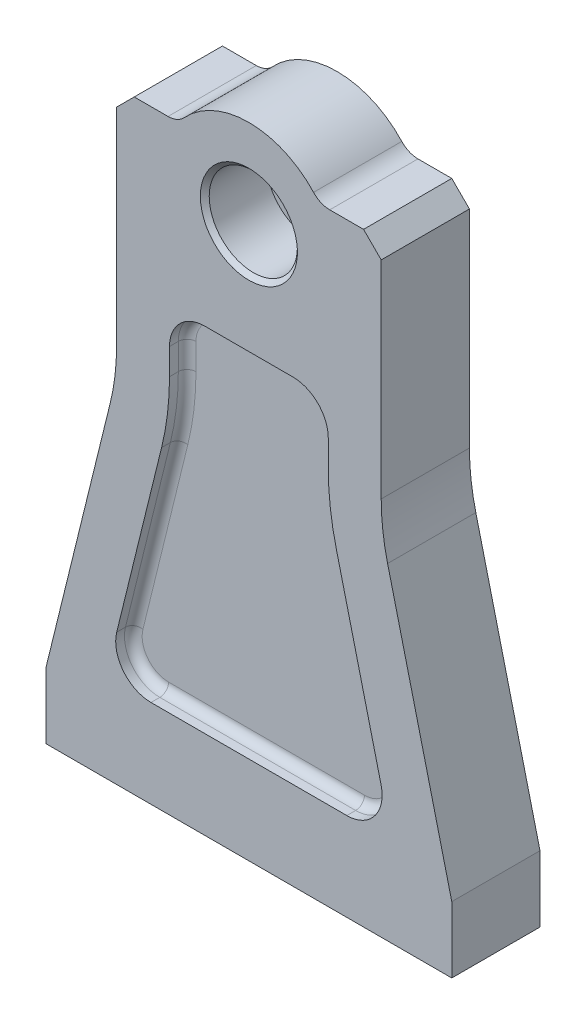
from build123d import *

# Parameters (mm, degrees)
SKETCH1_R                         = 6.5
BOSS_EXTRUDE1_DEPTH               = 10
SKETCH2_R                         = 10
CUT_EXTRUDE1_DEPTH                = 14
CHAMFER1_SIZE                     = 1
CHAMFER2_SIZE                     = 4
FILLET1_R                         = 5
CUT_EXTRUDE2_DEPTH                = 4
FILLET2_R                         = 2
FILLET2_OF_MIRROR2_R              = 2
M10X1_25_TAPPED_HOLE1_D           = 8.8
M10X1_25_TAPPED_HOLE1_DEPTH       = 20
M10X1_25_TAPPED_HOLE1_CSINK_D     = 10.05
M10X1_25_TAPPED_HOLE1_CSINK_ANGLE = 90
M10X1_25_TAPPED_HOLE1_TIP         = 2.643786724


with BuildPart() as part:
    # Sketch1 → Boss-Extrude1 (new, symmetric)
    with BuildSketch(Plane.XY):
        with BuildLine():
            Line((-46, 0), (46, 0))
            Line((46, 0), (46, 15))
            Line((46, 15), (31.449256053, 74.112397284))
            ThreePointArc((31.449256053, 74.112397284), (30.363636327, 80.044097084), (30, 86.06334964))
            Line((30, 86.06334964), (30, 137))
            Line((30, 137), (16, 137))
            ThreePointArc((16, 137), (0, 145), (-16, 137))
            Line((-16, 137), (-30, 137))
            Line((-30, 137), (-30, 86.06334964))
            ThreePointArc((-30, 86.06334964), (-30.363636327, 80.044097084), (-31.449256053, 74.112397284))
            Line((-31.449256053, 74.112397284), (-46, 15))
            Line((-46, 15), (-46, 0))
        make_face()
        with Locations((0, 125)):
            Circle(SKETCH1_R, mode=Mode.SUBTRACT)
    extrude(amount=BOSS_EXTRUDE1_DEPTH, both=True)

    # Sketch2 → Cut-Extrude1 (cut)
    with BuildSketch(Plane.XY.offset(10)):
        with Locations((0, 125)):
            Circle(SKETCH2_R)
    extrude(amount=-CUT_EXTRUDE1_DEPTH, mode=Mode.SUBTRACT)

    # Chamfer1
    chamfer1_edges = [part.edges().sort_by_distance(p)[0] for p in [
        (-10, 125, 10),
    ]]
    chamfer(chamfer1_edges, length=CHAMFER1_SIZE)

    # Chamfer2
    chamfer2_edges = [part.edges().sort_by_distance(p)[0] for p in [
        (-30, 137, 0),
        (30, 137, 0),
    ]]
    chamfer(chamfer2_edges, length=CHAMFER2_SIZE)

    # Fillet1
    fillet1_edges = [part.edges().sort_by_distance(p)[0] for p in [
        (-16, 137, 0),
        (16, 137, 0),
    ]]
    fillet(fillet1_edges, radius=FILLET1_R)

    # Sketch10 → Cut-Extrude2 (cut)
    with BuildSketch(Plane.XY.offset(10)):
        with BuildLine():
            ThreePointArc((18, 86.06334964), (18.450909046, 78.59947647), (19.797077506, 71.244168718))
            Line((19.797077506, 71.244168718), (29.971112298, 29.912152377))
            ThreePointArc((29.971112298, 29.912152377), (28.49970745, 23.065287193), (22.202993266, 20))
            Line((22.202993266, 20), (-22.202993266, 20))
            ThreePointArc((-22.202993266, 20), (-28.49970745, 23.065287193), (-29.971112298, 29.912152377))
            Line((-29.971112298, 29.912152377), (-19.797077506, 71.244168718))
            ThreePointArc((-19.797077506, 71.244168718), (-18.450909046, 78.59947647), (-18, 86.06334964))
            Line((-18, 86.06334964), (-18, 92))
            ThreePointArc((-18, 92), (-15.656854249, 97.656854249), (-10, 100))
            Line((-10, 100), (10, 100))
            ThreePointArc((10, 100), (15.656854249, 97.656854249), (18, 92))
            Line((18, 92), (18, 86.06334964))
        make_face()
    cut_extrude2 = extrude(amount=-CUT_EXTRUDE2_DEPTH, mode=Mode.SUBTRACT)

    # Fillet2
    fillet2_edges = [part.edges().sort_by_distance(p)[0] for p in [
        (-24.884094902, 50.578160548, 6),
        (-18, 89.03167482, 6),
        (15.656854249, 97.656854249, 6),
        (18, 89.03167482, 6),
        (18.450909046, 78.59947647, 6),
        (-28.49970745, 23.065287193, 6),
        (-18.450909046, 78.59947647, 6),
        (-15.656854249, 97.656854249, 6),
        (0, 100, 6),
        (24.884094902, 50.578160548, 6),
        (28.49970745, 23.065287193, 6),
        (0, 20, 6),
    ]]
    fillet(fillet2_edges, radius=FILLET2_R)

    # Mirror2: Cut-Extrude2 across plane
    add(cut_extrude2.mirror(Plane.XY), mode=Mode.SUBTRACT)

    # Fillet2 of Mirror2
    fillet2_of_mirror2_edges = [part.edges().sort_by_distance(p)[0] for p in [
        (-24.884094902, 50.578160548, -6),
        (-18, 89.03167482, -6),
        (15.656854249, 97.656854249, -6),
        (18, 89.03167482, -6),
        (18.450909046, 78.59947647, -6),
        (-28.49970745, 23.065287193, -6),
        (-18.450909046, 78.59947647, -6),
        (-15.656854249, 97.656854249, -6),
        (0, 100, -6),
        (24.884094902, 50.578160548, -6),
        (28.49970745, 23.065287193, -6),
        (0, 20, -6),
    ]]
    fillet(fillet2_of_mirror2_edges, radius=FILLET2_OF_MIRROR2_R)

    # M10x1.25 Tapped Hole1
    with Locations(Plane(origin=(0, 0, 0), x_dir=(-1, 0, 0), z_dir=(0, -1, 0))):
        with Locations((-30, 0), (30, 0)):
            CounterSinkHole(M10X1_25_TAPPED_HOLE1_D / 2, M10X1_25_TAPPED_HOLE1_CSINK_D / 2, depth=M10X1_25_TAPPED_HOLE1_DEPTH, counter_sink_angle=M10X1_25_TAPPED_HOLE1_CSINK_ANGLE)
            with Locations((0, 0, -(M10X1_25_TAPPED_HOLE1_DEPTH + M10X1_25_TAPPED_HOLE1_TIP / 2))):  # 118° drill point
                Cone(0, M10X1_25_TAPPED_HOLE1_D / 2, M10X1_25_TAPPED_HOLE1_TIP, mode=Mode.SUBTRACT)


solid = part.part
